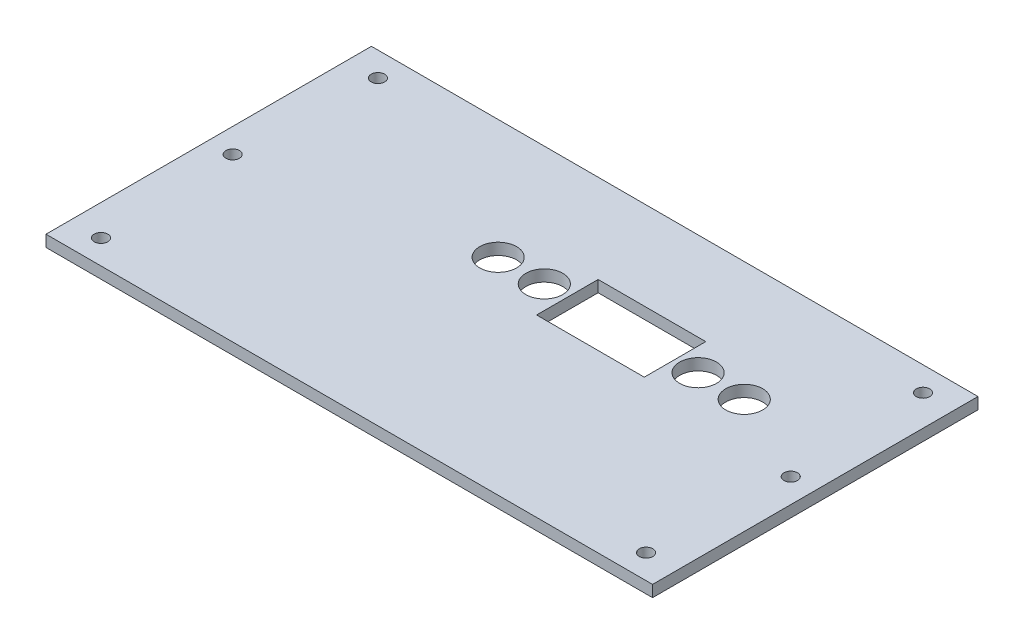
from build123d import *

# Parameters (mm, degrees)
SKETCH1_W           = 250.444
SKETCH1_H           = 134.366
SKETCH1_R           = 7.62
SKETCH1_R_2         = 2.794
SKETCH1_W_2         = 44.45
SKETCH1_H_2         = 25.4
BOSS_EXTRUDE1_DEPTH = 4.7625


with BuildPart() as part:
    # Sketch1 → Boss-Extrude1 (new body)
    with BuildSketch(Plane(origin=(0, 0, 0), x_dir=(1, 0, 0), z_dir=(0, 1, 0))):
        with Locations((-27.178, -17.907)):
            Rectangle(SKETCH1_W, SKETCH1_H)
        with Locations(Location((-50.8, 0, 0), (0, 0, 90))):
            Circle(SKETCH1_R, mode=Mode.SUBTRACT)
        with Locations(Location((-31.75, 0, 0), (0, 0, 90))):
            Circle(SKETCH1_R, mode=Mode.SUBTRACT)
        with Locations(Location((31.75, 0, 0), (0, 0, 90))):
            Circle(SKETCH1_R, mode=Mode.SUBTRACT)
        with Locations(Location((50.8, 0, 0), (0, 0, 90))):
            Circle(SKETCH1_R, mode=Mode.SUBTRACT)
        with Locations(Location((-139.7, 39.2684, 0), (0, 0, 90))):
            Circle(SKETCH1_R_2, mode=Mode.SUBTRACT)
        with Locations(Location((85.344, 39.2684, 0), (0, 0, 90))):
            Circle(SKETCH1_R_2, mode=Mode.SUBTRACT)
        with Locations(Location((88.0364, -18.034, 0), (0, 0, 90))):
            Circle(SKETCH1_R_2, mode=Mode.SUBTRACT)
        with Locations(Location((85.344, -75.0824, 0), (0, 0, 90))):
            Circle(SKETCH1_R_2, mode=Mode.SUBTRACT)
        with Locations(Location((-139.7, -75.0824, 0), (0, 0, 90))):
            Circle(SKETCH1_R_2, mode=Mode.SUBTRACT)
        with Locations(Location((-142.3924, -18.034, 0), (0, 0, 90))):
            Circle(SKETCH1_R_2, mode=Mode.SUBTRACT)
        Rectangle(SKETCH1_W_2, SKETCH1_H_2, mode=Mode.SUBTRACT)
    extrude(amount=BOSS_EXTRUDE1_DEPTH)


solid = part.part
